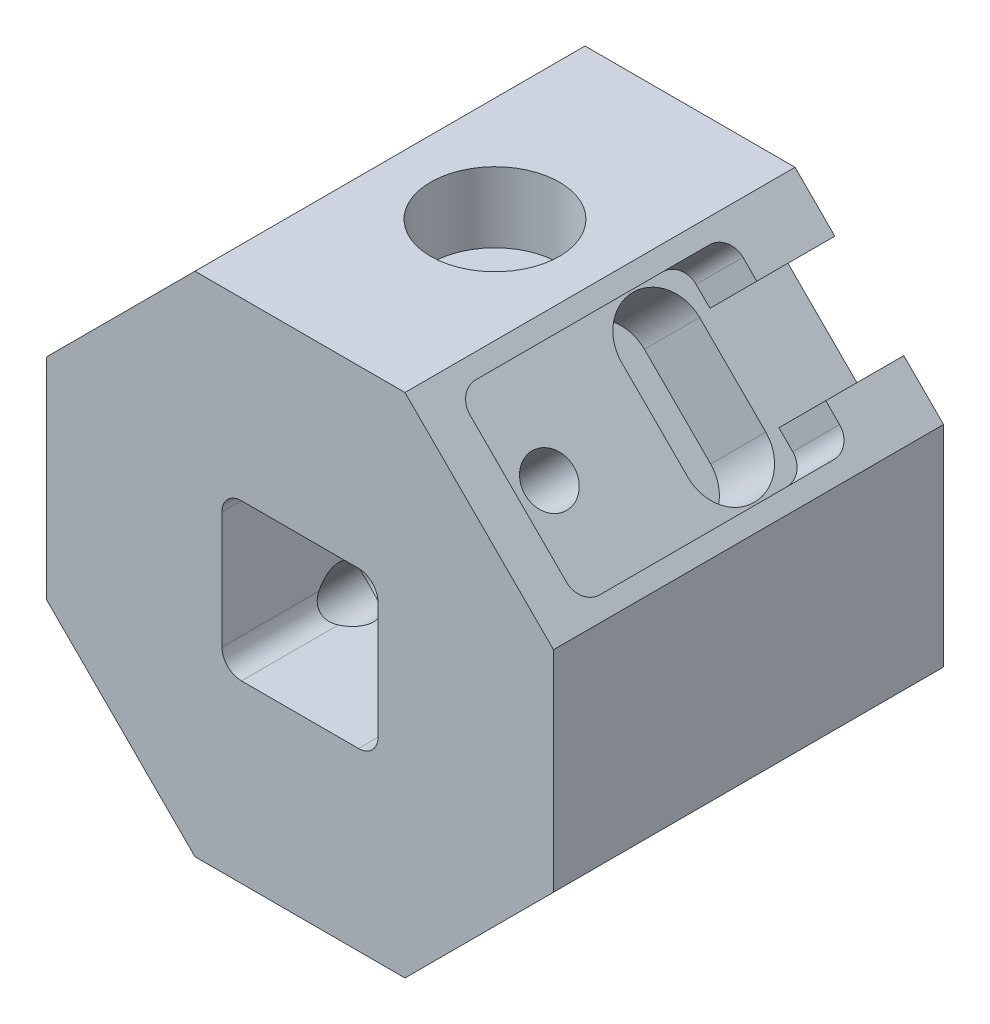
from build123d import *

# Parameters (mm, degrees)
SKETCH1_W                                            = 4
SKETCH1_H                                            = 4
BOSS_EXTRUDE1_DEPTH                                  = 10
FILLET2_R                                            = 0.5
CUT_EXTRUDE3_DEPTH                                   = 1.7
FILLET3_R                                            = 0.5
CUT_EXTRUDE4_DEPTH                                   = 2
CIRPATTERN14_COUNT                                   = 4
FILLET3_OF_CIRPATTERN14_R                            = 0.5
CBORE_FOR_M1_6_HEXAGON_SOCKET_HEAD_CAP_S_D           = 1.8
CBORE_FOR_M1_6_HEXAGON_SOCKET_HEAD_CAP_S_CBORE_D     = 3.3
CBORE_FOR_M1_6_HEXAGON_SOCKET_HEAD_CAP_S_CBORE_DEPTH = 1.8


with BuildPart() as part:
    # Sketch1 → Boss-Extrude1 (new body)
    with BuildSketch(Plane.XY):
        Polygon((-2.692388155, 6.5), (-6.5, 2.692388155), (-6.5, -2.692388155), (-2.692388155, -6.5), (2.692388155, -6.5), (6.5, -2.692388155), (6.5, 2.692388155), (2.692388155, 6.5), align=None)
        Rectangle(SKETCH1_W, SKETCH1_H, mode=Mode.SUBTRACT)
    extrude(amount=BOSS_EXTRUDE1_DEPTH)

    # Fillet2
    fillet2_edges = [part.edges().sort_by_distance(p)[0] for p in [
        (-2, -2, 5),
        (2, -2, 5),
        (2, 2, 5),
        (-2, 2, 5),
    ]]
    fillet(fillet2_edges, radius=FILLET2_R)

    # Sketch11 → Cut-Extrude3 (cut)
    with BuildSketch(Plane(origin=(4.596194078, 4.596194078, 0), x_dir=(0, 0, -1), z_dir=(0.7071067811865477, 0.7071067811865475, 0))):
        Polygon((-2, 2.25), (-9, 2.25), (-9, -2.25), (-2, -2.25), (-2, -1.25), (0, -1.25), (0, 1.25), (-2, 1.25), align=None)
    cut_extrude3 = extrude(amount=-CUT_EXTRUDE3_DEPTH, mode=Mode.SUBTRACT)

    # Fillet3
    fillet3_edges = [part.edges().sort_by_distance(p)[0] for p in [
        (5.586143571, 2.404163056, 9),
        (5.586143571, 2.404163056, 2),
        (2.404163056, 5.586143571, 2),
        (2.404163056, 5.586143571, 9),
    ]]
    fillet(fillet3_edges, radius=FILLET3_R)

    # Sketch13 → Tap Drill for M1.6 Tap2 (revolve, cut)
    with BuildSketch(Plane(origin=(3.39411255, 3.39411255, 7), x_dir=(-0.7071067811865475, 0.7071067811865477, 0), z_dir=(0, 0, 1))):
        Polygon((0, 0), (0, 5.375537887), (0.625, 5), (0.625, 0), align=None)
    tap_drill_for_m1_6_tap2 = revolve(axis=Axis((7.88424061, 7.88424061, 7), (-0.7071067811865477, -0.7071067811865475, 0)), mode=Mode.SUBTRACT)

    # Sketch14 → Cut-Extrude4 (cut)
    with BuildSketch(Plane(origin=(3.39411255, 3.39411255, 0), x_dir=(0, 0, -1), z_dir=(0.7071067811865476, 0.7071067811865476, 0))):
        with BuildLine():
            Line((-2.3, 1.2), (-2.3, -1.2))
            ThreePointArc((-2.3, -1.2), (-3.3, -2.2), (-4.3, -1.2))
            Line((-4.3, -1.2), (-4.3, 1.2))
            ThreePointArc((-4.3, 1.2), (-3.3, 2.2), (-2.3, 1.2))
        make_face()
    cut_extrude4 = extrude(amount=-CUT_EXTRUDE4_DEPTH, mode=Mode.SUBTRACT)

    # CirPattern14: Cut-Extrude3, Tap Drill for M1.6 Tap2, Cut-Extrude4 ×4 about axis
    cirpattern14_axis = Axis((0, 0, 10.5), (0, 0, -1))
    add([cut_extrude3.rotate(cirpattern14_axis, i * 360 / CIRPATTERN14_COUNT) for i in range(1, CIRPATTERN14_COUNT)], mode=Mode.SUBTRACT)
    add([tap_drill_for_m1_6_tap2.rotate(cirpattern14_axis, i * 360 / CIRPATTERN14_COUNT) for i in range(1, CIRPATTERN14_COUNT)], mode=Mode.SUBTRACT)
    add([cut_extrude4.rotate(cirpattern14_axis, i * 360 / CIRPATTERN14_COUNT) for i in range(1, CIRPATTERN14_COUNT)], mode=Mode.SUBTRACT)

    # Fillet3 of CirPattern14
    fillet3_of_cirpattern14_edges = [part.edges().sort_by_distance(p)[0] for p in [
        (2.404163056, -5.586143571, 9),
        (2.404163056, -5.586143571, 2),
        (5.586143571, -2.404163056, 2),
        (5.586143571, -2.404163056, 9),
        (-5.586143571, -2.404163056, 9),
        (-5.586143571, -2.404163056, 2),
        (-2.404163056, -5.586143571, 2),
        (-2.404163056, -5.586143571, 9),
        (-2.404163056, 5.586143571, 9),
        (-2.404163056, 5.586143571, 2),
        (-5.586143571, 2.404163056, 2),
        (-5.586143571, 2.404163056, 9),
    ]]
    fillet(fillet3_of_cirpattern14_edges, radius=FILLET3_OF_CIRPATTERN14_R)

    # CBORE for M1.6 Hexagon socket head cap screws1 (through all)
    with Locations(Plane(origin=(0, 6.5, 5), x_dir=(0, 0, 1), z_dir=(0, 1, 0))):
        with Locations((0, 0)):
            CounterBoreHole(CBORE_FOR_M1_6_HEXAGON_SOCKET_HEAD_CAP_S_D / 2, CBORE_FOR_M1_6_HEXAGON_SOCKET_HEAD_CAP_S_CBORE_D / 2, CBORE_FOR_M1_6_HEXAGON_SOCKET_HEAD_CAP_S_CBORE_DEPTH)


solid = part.part
